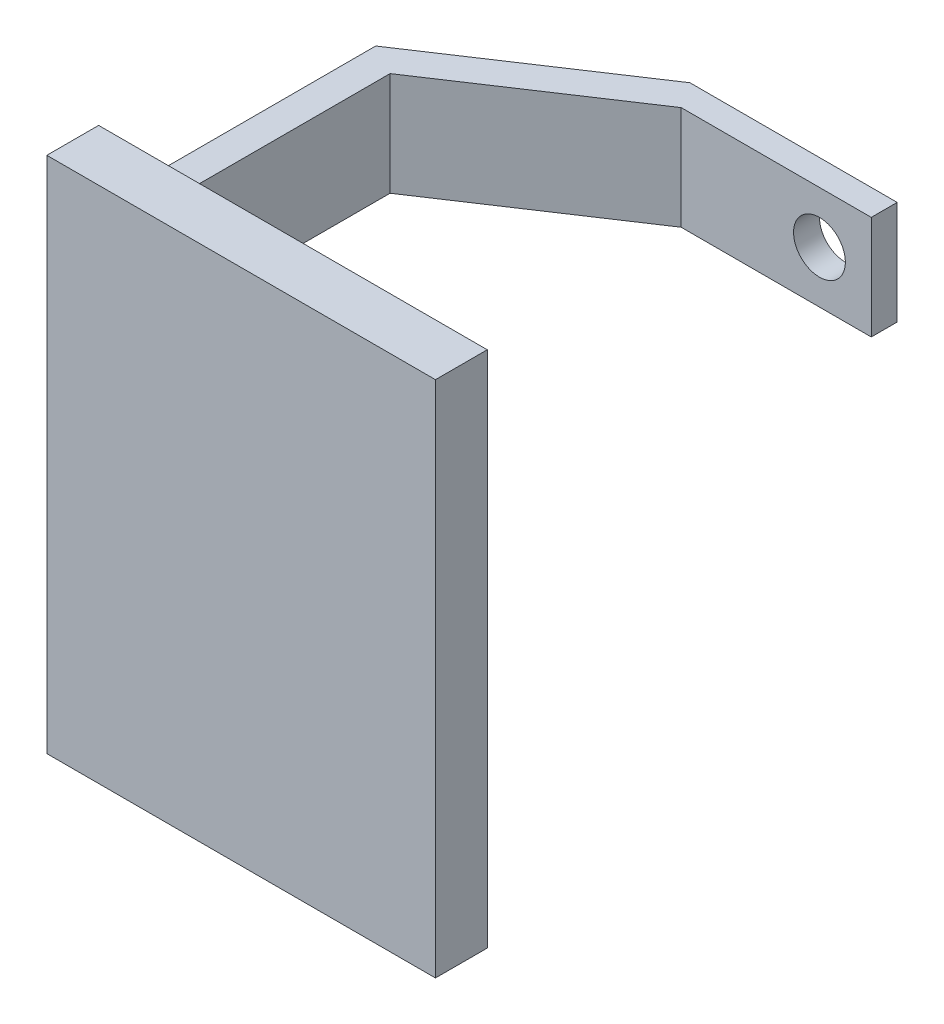
from build123d import *

# Parameters (mm, degrees)
SKETCH1_W                = 20
SKETCH1_H                = 20
SKETCH1_R                = 5
BOSS_EXTRUDE1_DEPTH      = 5
SKETCH2_W                = 5
SKETCH2_H                = 20
BOSS_EXTRUDE2_DEPTH      = 20
BOSS_EXTRUDE6_DEPTH      = 20
BOSS_EXTRUDE7_DEPTH      = 40
BOSS_EXTRUDE7_DEPTH_BACK = 60
SKETCH9_W                = 75
SKETCH9_H                = 10


with BuildPart() as part:
    # Sketch1 → Boss-Extrude1 (new body)
    with BuildSketch(Plane.XY):
        Rectangle(SKETCH1_W, SKETCH1_H)
        Circle(SKETCH1_R, mode=Mode.SUBTRACT)
    extrude(amount=BOSS_EXTRUDE1_DEPTH)

    # Sketch2 → Boss-Extrude2 (add)
    with BuildSketch(Plane.ZY.offset(10)):
        with Locations((2.5, 0)):
            Rectangle(SKETCH2_W, SKETCH2_H)
    extrude(amount=BOSS_EXTRUDE2_DEPTH)

    # Sketch8 → Boss-Extrude6 (add)
    with BuildSketch(Plane.XZ.offset(10)):
        Polygon((35.075402168, 114.183233441), (-39.924597832, 114.183233441), (-34.924597832, 110.86660865), (-39.357847412, 104.183233441), (35.075402168, 104.183233441), align=None)
        Polygon((-34.924597832, 110.86660865), (-39.924597832, 114.183233441), (-39.924597832, 104.183233441), (-39.357847412, 104.183233441), align=None)
        Polygon((-39.924597832, 114.183233441), (-66.457596155, 74.183233441), (-60.457596155, 74.183233441), (-60.457596155, 72.374165373), (-39.357847412, 104.183233441), (-39.924597832, 104.183233441), align=None)
        Polygon((-60.457596155, 74.183233441), (-66.457596155, 74.183233441), (-61.457596155, 70.86660865), (-60.457596155, 72.374165373), align=None)
        Polygon((-66.457596155, 74.183233441), (-66.457596155, 24.183233441), (-63.140971364, 29.183233441), (-60.457596155, 27.403283692), (-60.457596155, 72.374165373), (-61.457596155, 70.86660865), align=None)
        Polygon((-63.140971364, 29.183233441), (-66.457596155, 24.183233441), (-60.457596155, 24.183233441), (-60.457596155, 27.403283692), align=None)
        Polygon((-66.457596155, 24.183233441), (-30, 0), (-30, 5), (-26.68337521, 5), (-60.457596155, 27.403283692), (-60.457596155, 24.183233441), align=None)
    extrude(amount=-BOSS_EXTRUDE6_DEPTH)

    # Sketch9 → Boss-Extrude7 (add, two sides: drawn at the far end of the back side and taken through both)
    with BuildSketch(Plane.XZ.offset(10).offset(-BOSS_EXTRUDE7_DEPTH_BACK)):
        with Locations((-2.424597832, 109.183233441)):
            Rectangle(SKETCH9_W, SKETCH9_H)
    extrude(amount=BOSS_EXTRUDE7_DEPTH + BOSS_EXTRUDE7_DEPTH_BACK)


solid = part.part
